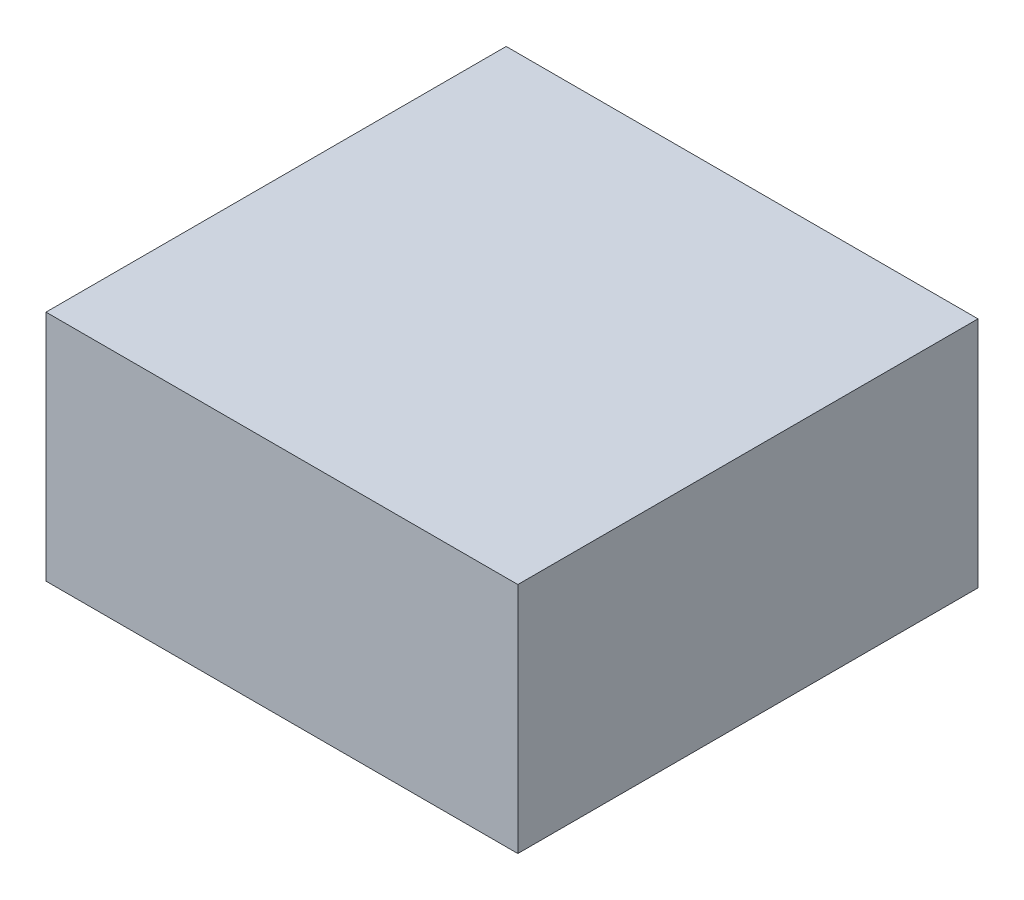
from build123d import *

# Parameters (mm, degrees)
SKETCH_1_W                        = 40.5
SKETCH_1_H                        = 20
MG995_SUPPLIER_40P5X20X39P5_DEPTH = 39.5


with BuildPart() as part:
    # 草图1 → MG995_SUPPLIER_40p5x20x39p5 (new body)
    with BuildSketch(Plane.XY):
        with Locations((10.25, 0)):
            Rectangle(SKETCH_1_W, SKETCH_1_H)
    extrude(amount=MG995_SUPPLIER_40P5X20X39P5_DEPTH)


solid = part.part
